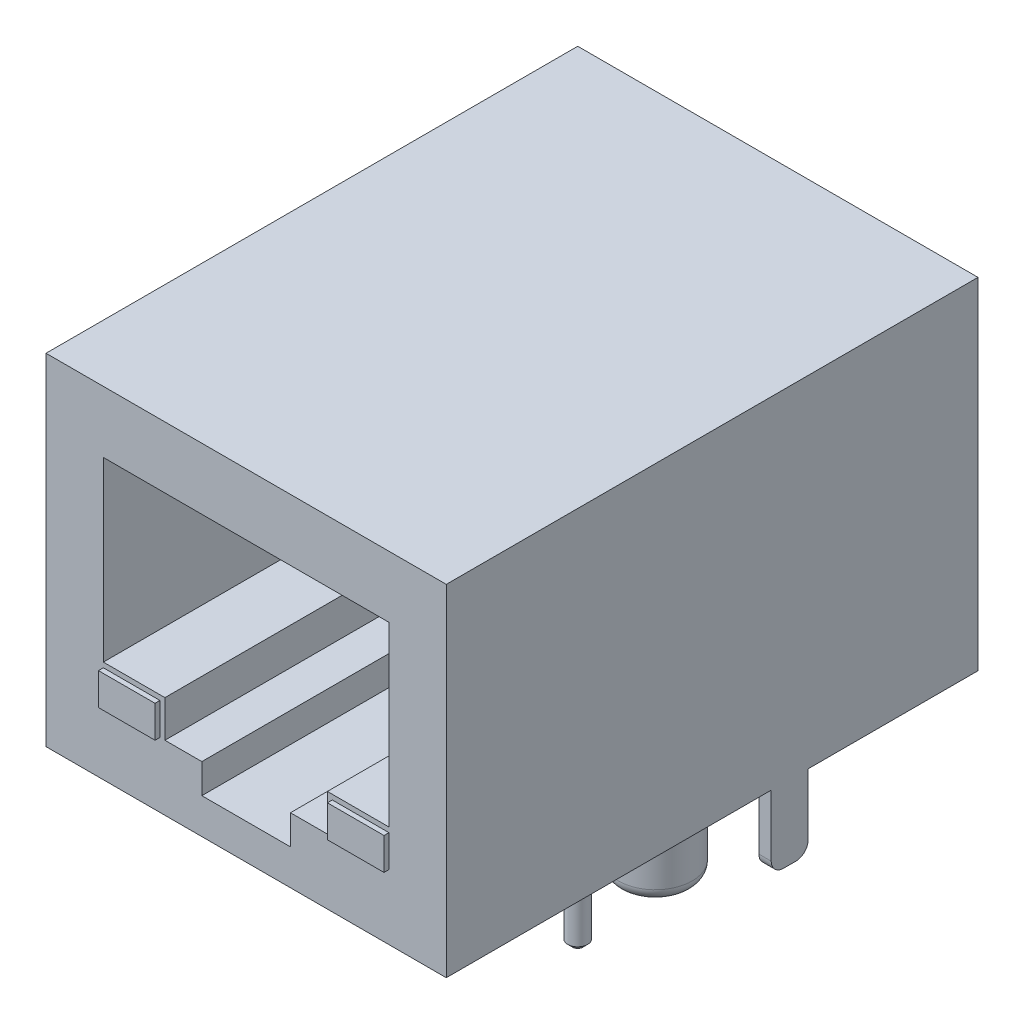
from build123d import *

# Parameters (mm, degrees)
SKETCH_1_W             = 16.26
SKETCH_1_H             = 21.6
EXTRUDE_1_DEPTH        = 13.84
SKETCH_2_R             = 1.5
EXTRUDE_2_DEPTH        = 3
FILLET_1_R             = 0.5
SKETCH_3_W             = 0.5
SKETCH_3_H             = 1.5
EXTRUDE_3_DEPTH        = 3
FILLET_2_R             = 0.5
SKETCH_4_R             = 0.4
EXTRUDE_4_DEPTH        = 3
SKETCH_5_R             = 0.35
EXTRUDE_5_DEPTH        = 3
PATTERN_LINEAR_1_COUNT = 4
PATTERN_LINEAR_1_PITCH = 2.54
CHAMFER_1_SIZE         = 0.2
CUT_EXTRUDE_1_DEPTH    = 13
SKETCH_7_W             = 2.3
SKETCH_7_H             = 1.3
EXTRUDE_6_DEPTH        = 0.2
SKETCH_8_W             = 2.3
SKETCH_8_H             = 1.3
EXTRUDE_7_DEPTH        = 0.2


with BuildPart() as part:
    # Эскиз1 → Бобышка-Вытянуть1 (new body)
    with BuildSketch(Plane(origin=(0, 0, 0), x_dir=(1, 0, 0), z_dir=(0, 1, 0))):
        Rectangle(SKETCH_1_W, SKETCH_1_H)
    extrude(amount=EXTRUDE_1_DEPTH)

    # Эскиз2 → Бобышка-Вытянуть2 (add)
    with BuildSketch(Plane(origin=(0, 0, 0), x_dir=(1, 0, 0), z_dir=(0, 1, 0))):
        with Locations(Location((5.72, 0.1, 0), (0, 0, 270))):
            Circle(SKETCH_2_R)
        with Locations(Location((-5.72, 0.1, 0), (0, 0, 270))):
            Circle(SKETCH_2_R)
    extrude(amount=-EXTRUDE_2_DEPTH)

    # Скругление1
    fillet_1_edges = [part.edges().sort_by_distance(p)[0] for p in [
        (5.72, -3, -1.6),
        (-5.72, -3, -1.6),
    ]]
    fillet(fillet_1_edges, radius=FILLET_1_R)

    # Эскиз3 → Бобышка-Вытянуть3 (add)
    with BuildSketch(Plane(origin=(0, 0, 0), x_dir=(1, 0, 0), z_dir=(0, 1, 0))):
        with Locations((-7.88, 3.15)):
            Rectangle(SKETCH_3_W, SKETCH_3_H)
        with Locations((7.88, 3.15)):
            Rectangle(SKETCH_3_W, SKETCH_3_H)
    extrude(amount=-EXTRUDE_3_DEPTH)

    # Скругление2
    fillet_2_edges = [part.edges().sort_by_distance(p)[0] for p in [
        (-7.88, -3, -2.4),
        (-7.88, -3, -3.9),
        (7.88, -3, -2.4),
        (7.88, -3, -3.9),
    ]]
    fillet(fillet_2_edges, radius=FILLET_2_R)

    # Эскиз4 → Бобышка-Вытянуть4 (add)
    with BuildSketch(Plane(origin=(0, 0, 0), x_dir=(1, 0, 0), z_dir=(0, 1, 0))):
        with Locations(Location((-6.63, -3.96, 0), (0, 0, 270))):
            Circle(SKETCH_4_R)
        with Locations(Location((-4.09, -3.96, 0), (0, 0, 270))):
            Circle(SKETCH_4_R)
        with Locations(Location((4.09, -3.96, 0), (0, 0, 270))):
            Circle(SKETCH_4_R)
        with Locations(Location((6.63, -3.96, 0), (0, 0, 270))):
            Circle(SKETCH_4_R)
    extrude(amount=-EXTRUDE_4_DEPTH)

    # Эскиз5 → Бобышка-Вытянуть5 (add)
    with BuildSketch(Plane(origin=(0, 0, 0), x_dir=(1, 0, 0), z_dir=(0, 1, 0))):
        with Locations(Location((-4.45, 6.46, 0), (0, 0, 270))):
            Circle(SKETCH_5_R)
        with Locations(Location((-3.18, 9, 0), (0, 0, 270))):
            Circle(SKETCH_5_R)
    extrude_5 = extrude(amount=-EXTRUDE_5_DEPTH)

    # Линейный массив1: Бобышка-Вытянуть5 ×4
    with Locations(*[(i * PATTERN_LINEAR_1_PITCH, 0, 0) for i in range(1, PATTERN_LINEAR_1_COUNT)]):
        add(extrude_5)

    # Фаска1
    chamfer_1_edges = [part.edges().sort_by_distance(p)[0] for p in [
        (-0.64, -3, -9.35),
        (1.9, -3, -9.35),
        (4.44, -3, -9.35),
        (-1.91, -3, -6.81),
        (0.63, -3, -6.81),
        (3.17, -3, -6.81),
        (-6.63, -3, 3.56),
        (-4.09, -3, 3.56),
        (4.09, -3, 3.56),
        (6.63, -3, 3.56),
        (-4.45, -3, -6.81),
        (-3.18, -3, -9.35),
    ]]
    chamfer(chamfer_1_edges, length=CHAMFER_1_SIZE)

    # Эскиз6 → Вырез-Вытянуть1 (cut)
    with BuildSketch(Plane.XY.offset(10.8)):
        Polygon((-5.8, 11.34), (5.8, 11.34), (5.8, 4.14), (3.3, 4.14), (3.3, 2.64), (1.8, 2.64), (1.8, 1.44), (-1.8, 1.44), (-1.8, 2.64), (-3.3, 2.64), (-3.3, 4.14), (-5.8, 4.14), align=None)
    extrude(amount=-CUT_EXTRUDE_1_DEPTH, mode=Mode.SUBTRACT)

    # Эскиз7 → Бобышка-Вытянуть6 (add)
    with BuildSketch(Plane.XY.offset(10.8)):
        with Locations((-4.65, 3.29)):
            Rectangle(SKETCH_7_W, SKETCH_7_H)
    extrude(amount=EXTRUDE_6_DEPTH)

    # Эскиз8 → Бобышка-Вытянуть7 (add)
    with BuildSketch(Plane.XY.offset(10.8)):
        with Locations((4.65, 3.29)):
            Rectangle(SKETCH_8_W, SKETCH_8_H)
    extrude(amount=EXTRUDE_7_DEPTH)


solid = part.part
